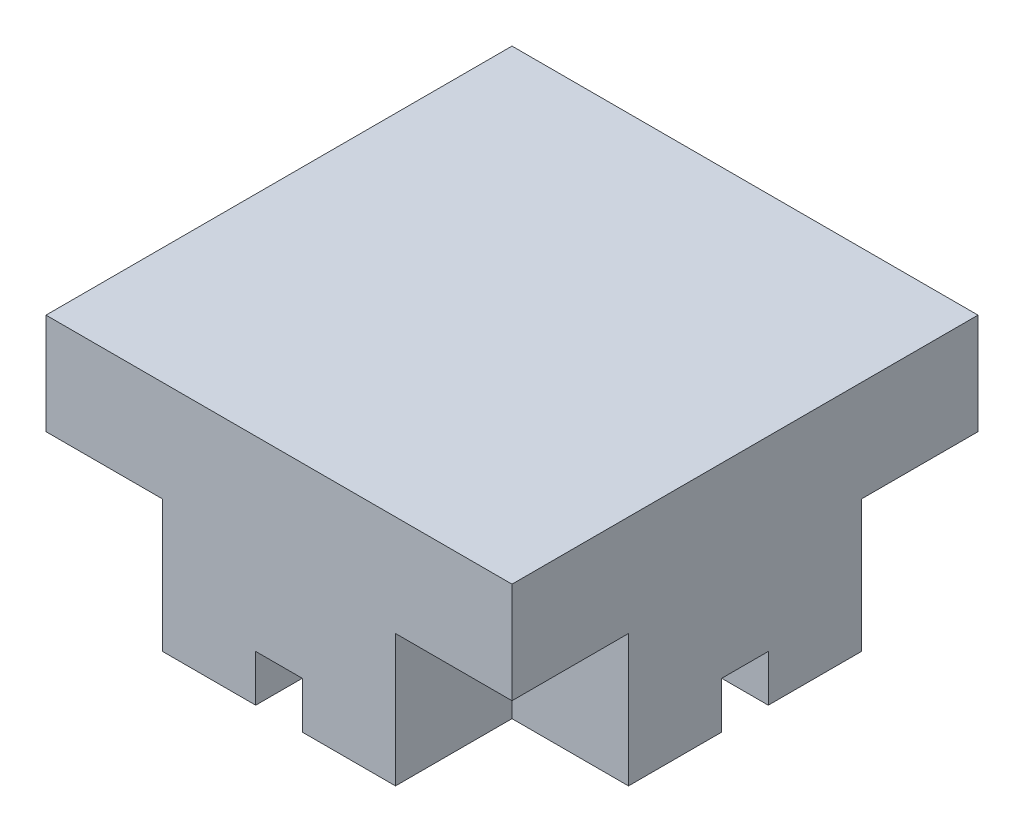
from build123d import *

# Parameters (mm, degrees)
SKETCH1_W           = 3000
SKETCH1_H           = 3000
BOSS_EXTRUDE1_DEPTH = 1500
SKETCH2_W           = 750
SKETCH2_H           = 750
CUT_EXTRUDE1_DEPTH  = 850
SKETCH4_W           = 300
SKETCH4_H           = 300
CUT_EXTRUDE2_DEPTH  = 300


with BuildPart() as part:
    # Sketch1 → Boss-Extrude1 (new body)
    with BuildSketch(Plane(origin=(0, 0, 0), x_dir=(1, 0, 0), z_dir=(0, 1, 0))):
        Rectangle(SKETCH1_W, SKETCH1_H)
    extrude(amount=BOSS_EXTRUDE1_DEPTH)

    # Sketch2 → Cut-Extrude1 (cut)
    with BuildSketch(Plane.XZ):
        with Locations((-1125, 1125)):
            Rectangle(SKETCH2_W, SKETCH2_H)
        with Locations((1125, 1125)):
            Rectangle(SKETCH2_W, SKETCH2_H)
        with Locations((1125, -1125)):
            Rectangle(SKETCH2_W, SKETCH2_H)
        with Locations((-1125, -1125)):
            Rectangle(SKETCH2_W, SKETCH2_H)
    extrude(amount=-CUT_EXTRUDE1_DEPTH, mode=Mode.SUBTRACT)

    # Sketch4 → Cut-Extrude2 (cut)
    with BuildSketch(Plane.XZ):
        with Locations((0, 1350)):
            Rectangle(SKETCH4_W, SKETCH4_H)
        with Locations((1350, 0)):
            Rectangle(SKETCH4_W, SKETCH4_H)
        with Locations((0, -1350)):
            Rectangle(SKETCH4_W, SKETCH4_H)
        with Locations((-1350, 0)):
            Rectangle(SKETCH4_W, SKETCH4_H)
    extrude(amount=-CUT_EXTRUDE2_DEPTH, mode=Mode.SUBTRACT)


solid = part.part
